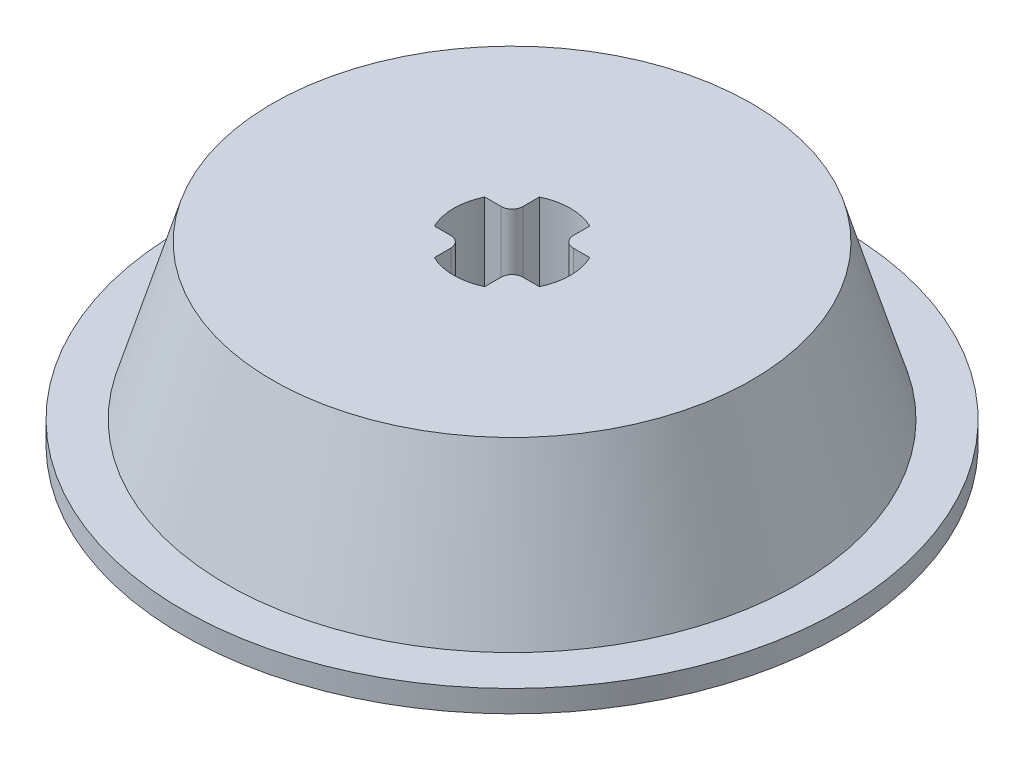
from build123d import *

# Parameters (mm, degrees)
SKETCH1_R           = 13
BOSS_EXTRUDE1_DEPTH = 7
SKETCH3_R           = 15
BOSS_EXTRUDE2_DEPTH = 1
SKETCH4_W           = 2.29
SKETCH4_H           = 2.29
CUT_EXTRUDE1_DEPTH  = 23.671568098
FILLET1_R           = 0.5


with BuildPart() as part:
    # Sketch1 → Boss-Extrude1 (new body)
    with BuildSketch(Plane(origin=(0, 0, 0), x_dir=(1, 0, 0), z_dir=(0, 1, 0))):
        with Locations(Location((0, 0, 0), (0, 0, 270))):
            Circle(SKETCH1_R)
    extrude(amount=BOSS_EXTRUDE1_DEPTH)

    # Sketch2 → Cut-Revolve1 (revolve, cut)
    with BuildSketch(Plane(origin=(0, 0, 0), x_dir=(0, 0, -1), z_dir=(1, 0, 0)), mode=Mode.PRIVATE) as cut_revolve1_sk:
        Polygon((-13, 0), (-10.907887029, 7), (-13, 7), align=None)
    revolve(cut_revolve1_sk.sketch.rotate(Axis((0, 0, 0), (0, 1, 0)), 180), axis=Axis((0, 0, 0), (0, 1, 0)), mode=Mode.SUBTRACT)

    # Sketch3 → Boss-Extrude2 (add)
    with BuildSketch(Plane(origin=(0, 0, 0), x_dir=(-1, 0, 0), z_dir=(0, -1, 0))):
        with Locations(Location((0, 0, 0), (0, 0, 90))):
            Circle(SKETCH3_R)
    extrude(amount=BOSS_EXTRUDE2_DEPTH)

    # Sketch4 → Cut-Extrude1 (cut, through all)
    with BuildSketch(Plane.XZ.offset(1)):
        Rectangle(SKETCH4_W, SKETCH4_H)
        with BuildLine():
            Line((-2.389869243, -1.145), (-1.145, -1.145))
            Line((-1.145, -1.145), (-1.145, 1.145))
            Line((-1.145, 1.145), (-2.389869243, 1.145))
            ThreePointArc((-2.389869243, 1.145), (-2.65, 0), (-2.389869243, -1.145))
        make_face()
        with BuildLine():
            Line((-1.145, 1.145), (1.145, 1.145))
            Line((1.145, 1.145), (1.145, 2.389869243))
            ThreePointArc((1.145, 2.389869243), (0, 2.65), (-1.145, 2.389869243))
            Line((-1.145, 2.389869243), (-1.145, 1.145))
        make_face()
        with BuildLine():
            Line((1.145, 1.145), (1.145, -1.145))
            Line((1.145, -1.145), (2.389869243, -1.145))
            ThreePointArc((2.389869243, -1.145), (2.584149134, -0.587088795), (2.65, 0))
            ThreePointArc((2.65, 0), (2.584149134, 0.587088795), (2.389869243, 1.145))
            Line((2.389869243, 1.145), (1.145, 1.145))
        make_face()
        with BuildLine():
            ThreePointArc((-1.145, -2.389869243), (0, -2.65), (1.145, -2.389869243))
            Line((1.145, -2.389869243), (1.145, -1.145))
            Line((1.145, -1.145), (-1.145, -1.145))
            Line((-1.145, -1.145), (-1.145, -2.389869243))
        make_face()
    extrude(amount=-CUT_EXTRUDE1_DEPTH, mode=Mode.SUBTRACT)

    # Fillet1
    fillet1_edges = [part.edges().sort_by_distance(p)[0] for p in [
        (-1.145, 3, 1.145),
        (1.145, 3, 1.145),
        (1.145, 3, -1.145),
        (-1.145, 3, -1.145),
    ]]
    fillet(fillet1_edges, radius=FILLET1_R)


solid = part.part
